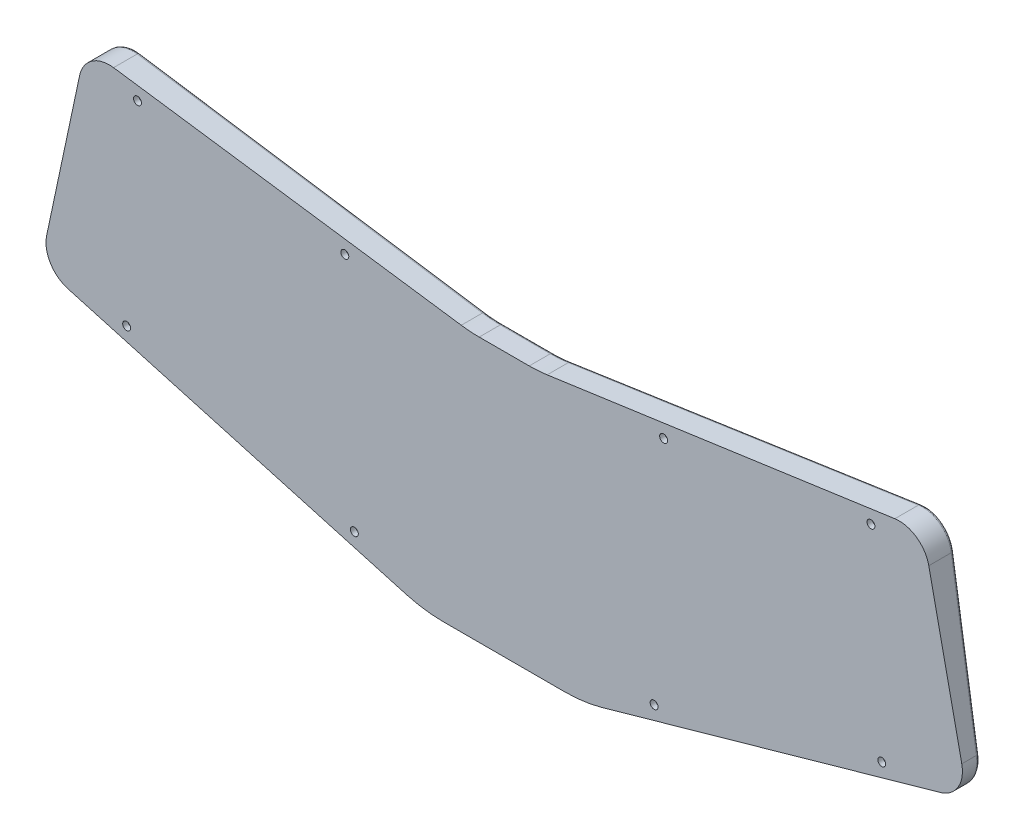
from build123d import *

# Parameters (mm, degrees)
MODEL_R                 = 2.8
BOSS_EXTRUDE1_DEPTH     = 10
CUT_EXTRUDE1_DEPTH      = 343.553555131
CUT_EXTRUDE1_DEPTH_BACK = 343.553555131
BOSS_EXTRUDE2_START     = 8
MODEL_3_R               = 2.8
MODEL_3_R_2             = 1.5
BOSS_EXTRUDE2_DEPTH     = 2
FILLET1_R               = 1


with BuildPart() as part:
    # Model → Boss-Extrude1 (new body)
    with BuildSketch(Plane.XY):
        with BuildLine():
            ThreePointArc((176.403737975, 57.612801897), (173.012294783, 57.253677545), (169.603999044, 57.1337718))
            Line((169.603999044, 57.1337718), (150.648829756, 57.1337718))
            ThreePointArc((150.648829756, 57.1337718), (147.240534017, 57.253677545), (143.849090824, 57.612801897))
            Line((143.849090824, 57.612801897), (12.081352867, 76.271030157))
            ThreePointArc((12.081352867, 76.271030157), (3.877804033, 74.308284837), (-0.779653775, 67.275599046))
            Line((-0.779653775, 67.275599046), (-13.274730709, 8.490883588))
            ThreePointArc((-13.274730709, 8.490883588), (-11.871459071, 0.157038619), (-5.151125733, -4.967340667))
            Line((-5.151125733, -4.967340667), (123.055393281, -41.169431628))
            ThreePointArc((123.055393281, -41.169431628), (129.986107868, -42.620640598), (137.050372447, -43.1074446))
            Line((137.050372447, -43.1074446), (183.202456353, -43.1074446))
            ThreePointArc((183.202456353, -43.1074446), (190.266720932, -42.620640598), (197.197435519, -41.169431628))
            Line((197.197435519, -41.169431628), (325.403954533, -4.967340667))
            ThreePointArc((325.403954533, -4.967340667), (332.124287871, 0.157038619), (333.527559509, 8.490883588))
            Line((333.527559509, 8.490883588), (321.032482575, 67.275599045))
            ThreePointArc((321.032482575, 67.275599045), (316.375024767, 74.308284836), (308.171475933, 76.271030156))
            Line((308.171475933, 76.271030156), (176.403737975, 57.612801897))
        make_face()
        with Locations((103.335575354, -30.405568574)):
            Circle(MODEL_R, mode=Mode.SUBTRACT)
        with Locations((17.039281052, -6.037803815)):
            Circle(MODEL_R, mode=Mode.SUBTRACT)
        with Locations((216.917253446, -30.405568574)):
            Circle(MODEL_R, mode=Mode.SUBTRACT)
        with Locations((303.213547748, -6.037803815)):
            Circle(MODEL_R, mode=Mode.SUBTRACT)
        with Locations((21.146353911, 69.937554571)):
            Circle(MODEL_R, mode=Mode.SUBTRACT)
        with Locations((99.718342652, 58.811810716)):
            Circle(MODEL_R, mode=Mode.SUBTRACT)
        with Locations((220.534486148, 58.811810716)):
            Circle(MODEL_R, mode=Mode.SUBTRACT)
        with Locations((299.10647489, 69.93755457)):
            Circle(MODEL_R, mode=Mode.SUBTRACT)
    extrude(amount=BOSS_EXTRUDE1_DEPTH)

    # Sketch2 → Cut-Extrude1 (cut, two sides: drawn at the far end of the back side and taken through both)
    with BuildSketch(Plane(origin=(0, 0, 0), x_dir=(0, 0, -1), z_dir=(1, 0, 0)).offset(-CUT_EXTRUDE1_DEPTH_BACK)):
        Polygon((0, -43.1074446), (-6, -43.1074446), (0, 76.271030156), align=None)
    extrude(amount=CUT_EXTRUDE1_DEPTH + CUT_EXTRUDE1_DEPTH_BACK, mode=Mode.SUBTRACT)

    # Model<3> → Boss-Extrude2 (add)
    # profile 1 of 8: a face of its own
    with BuildSketch(Plane.XY.offset(BOSS_EXTRUDE2_START)):
        with Locations(Location((17.039281052, -6.037803815, 0), (0, 0, 90))):
            Circle(MODEL_3_R)
        with Locations((17.039281052, -6.037803815)):
            Circle(MODEL_3_R_2, mode=Mode.SUBTRACT)
    # profile 2 of 8: a face of its own
    with BuildSketch(Plane.XY.offset(BOSS_EXTRUDE2_START)):
        with Locations(Location((103.335575354, -30.405568574, 0), (0, 0, 90))):
            Circle(MODEL_3_R)
        with Locations((103.335575354, -30.405568574)):
            Circle(MODEL_3_R_2, mode=Mode.SUBTRACT)
    # profile 3 of 8: a face of its own
    with BuildSketch(Plane.XY.offset(BOSS_EXTRUDE2_START)):
        with Locations(Location((216.917253446, -30.405568574, 0), (0, 0, 90))):
            Circle(MODEL_3_R)
        with Locations((216.917253446, -30.405568574)):
            Circle(MODEL_3_R_2, mode=Mode.SUBTRACT)
    # profile 4 of 8: a face of its own
    with BuildSketch(Plane.XY.offset(BOSS_EXTRUDE2_START)):
        with Locations(Location((303.213547748, -6.037803815, 0), (0, 0, 90))):
            Circle(MODEL_3_R)
        with Locations((303.213547748, -6.037803815)):
            Circle(MODEL_3_R_2, mode=Mode.SUBTRACT)
    # profile 5 of 8: a face of its own
    with BuildSketch(Plane.XY.offset(BOSS_EXTRUDE2_START)):
        with Locations(Location((299.10647489, 69.93755457, 0), (0, 0, 90))):
            Circle(MODEL_3_R)
        with Locations((299.10647489, 69.93755457)):
            Circle(MODEL_3_R_2, mode=Mode.SUBTRACT)
    # profile 6 of 8: a face of its own
    with BuildSketch(Plane.XY.offset(BOSS_EXTRUDE2_START)):
        with Locations(Location((220.534486148, 58.811810716, 0), (0, 0, 90))):
            Circle(MODEL_3_R)
        with Locations((220.534486148, 58.811810716)):
            Circle(MODEL_3_R_2, mode=Mode.SUBTRACT)
    # profile 7 of 8: a face of its own
    with BuildSketch(Plane.XY.offset(BOSS_EXTRUDE2_START)):
        with Locations(Location((99.718342652, 58.811810716, 0), (0, 0, 90))):
            Circle(MODEL_3_R)
        with Locations((99.718342652, 58.811810716)):
            Circle(MODEL_3_R_2, mode=Mode.SUBTRACT)
    # profile 8 of 8: a face of its own
    with BuildSketch(Plane.XY.offset(BOSS_EXTRUDE2_START)):
        with Locations(Location((21.146353911, 69.937554571, 0), (0, 0, 90))):
            Circle(MODEL_3_R)
        with Locations((21.146353911, 69.937554571)):
            Circle(MODEL_3_R_2, mode=Mode.SUBTRACT)
    extrude(amount=BOSS_EXTRUDE2_DEPTH)

    # Fillet1
    fillet1_edges = [part.edges().sort_by_distance(p)[0] for p in [
        (190.266885646, -42.620617789, 5.97553193),
        (160.1264144, -43.1074446, 6),
        (129.985943154, -42.620617789, 5.97553193),
        (58.952133774, -23.068386147, 4.992830567),
        (-11.873007386, 0.159604439, 3.825384394),
        (-7.027192242, 37.883241317, 1.929382441),
        (2.619961345, 73.289488627, 0.149853223),
        (77.96522185, 66.941916026, 0.468884235),
        (147.240512863, 57.253679035, 0.955818098),
        (160.1264144, 57.1337718, 0.961844674),
        (173.012315937, 57.253679035, 0.955818098),
        (242.287606954, 66.941916026, 0.468884235),
        (309.783785164, 76.384614612, 0),
        (317.632867453, 73.289488628, 0.149853223),
        (327.280021042, 37.883241316, 1.929382441),
        (332.125836186, 0.159604439, 3.825384394),
        (261.300695026, -23.068386147, 4.992830567),
    ]]
    fillet(fillet1_edges, radius=FILLET1_R)


solid = part.part
